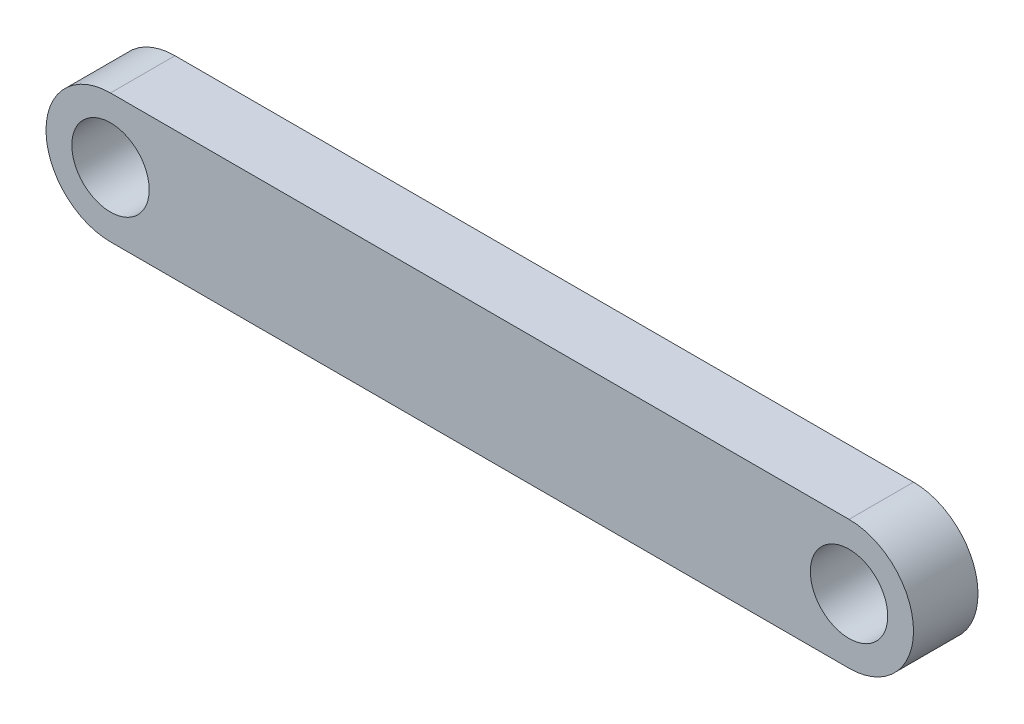
from build123d import *

# Parameters (mm, degrees)
SKETCH_2_R      = 30
EXTRUDE_1_DEPTH = 50


with BuildPart() as part:
    # 草图2 → 凸台-拉伸1 (new body)
    with BuildSketch(Plane.XY):
        with BuildLine():
            Line((0, 50), (572.6, 50))
            ThreePointArc((572.6, 50), (622.6, 0), (572.6, -50))
            Line((572.6, -50), (0, -50))
            ThreePointArc((0, -50), (-50, 0), (0, 50))
        make_face()
        Circle(SKETCH_2_R, mode=Mode.SUBTRACT)
        with Locations((572.6, 0)):
            Circle(SKETCH_2_R, mode=Mode.SUBTRACT)
    extrude(amount=EXTRUDE_1_DEPTH)


solid = part.part
